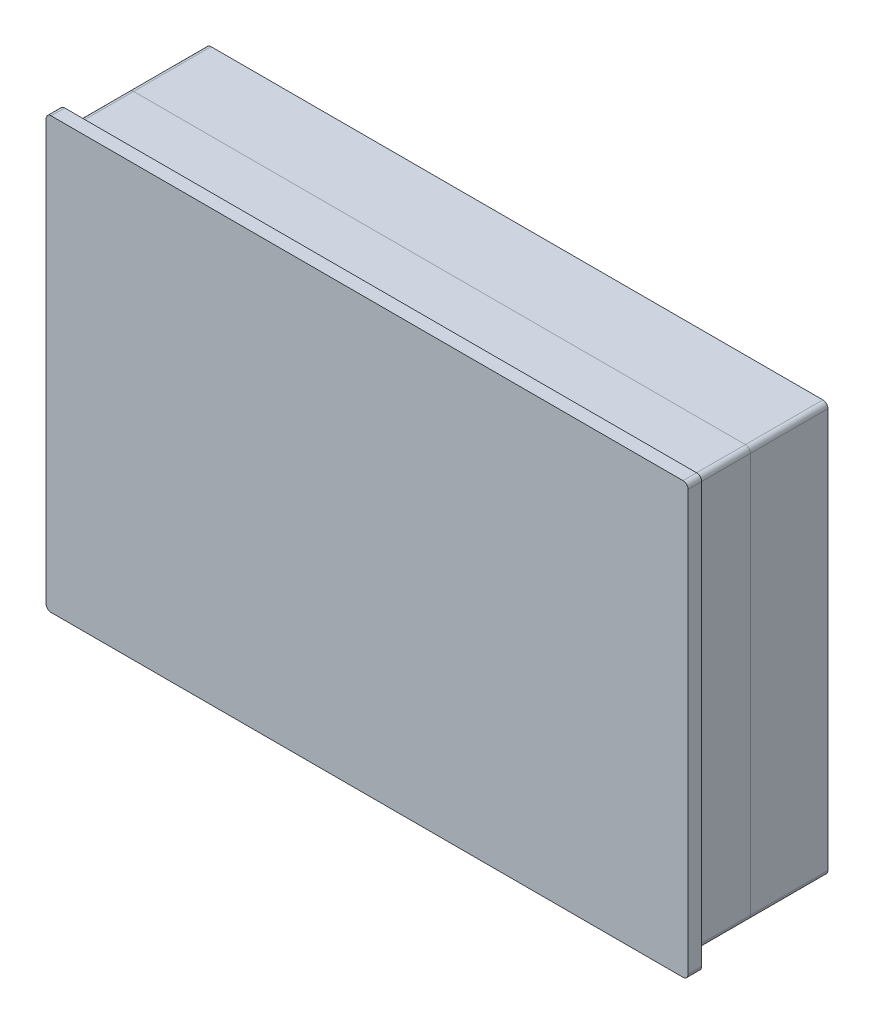
from build123d import *

# Parameters (mm, degrees)
SKETCH1_W           = 127.6
SKETCH1_H           = 85.5
BOSS_EXTRUDE1_DEPTH = 14.4
SKETCH2_W           = 127.6
SKETCH2_H           = 85.5
SKETCH2_W_2         = 123.6
SKETCH2_H_2         = 81.5
CUT_EXTRUDE1_DEPTH  = 11.7
SKETCH3_W           = 123.6
SKETCH3_H           = 81.5
BOSS_EXTRUDE2_DEPTH = 15.4
FILLET1_R           = 1
FILLET2_R           = 1


with BuildPart() as part:
    # Sketch1 → Boss-Extrude1 (new body)
    with BuildSketch(Plane.XY):
        with Locations((-77.146382855, -123.07484112)):
            Rectangle(SKETCH1_W, SKETCH1_H)
    extrude(amount=BOSS_EXTRUDE1_DEPTH)

    # Sketch2 → Cut-Extrude1 (cut)
    with BuildSketch(Plane(origin=(0, 0, 0), x_dir=(-1, 0, 0), z_dir=(0, 0, -1))):
        with Locations((77.146382855, -123.07484112)):
            Rectangle(SKETCH2_W, SKETCH2_H)
        with Locations((77.146382855, -123.07484112)):
            Rectangle(SKETCH2_W_2, SKETCH2_H_2, mode=Mode.SUBTRACT)
    extrude(amount=-CUT_EXTRUDE1_DEPTH, mode=Mode.SUBTRACT)

    # Fillet1
    fillet1_edges = [part.edges().sort_by_distance(p)[0] for p in [
        (-138.946382855, -82.32484112, 5.85),
        (-138.946382855, -163.82484112, 5.85),
        (-15.346382855, -163.82484112, 5.85),
        (-15.346382855, -82.32484112, 5.85),
        (-13.346382855, -165.82484112, 13.05),
        (-140.946382855, -165.82484112, 13.05),
        (-140.946382855, -80.32484112, 13.05),
        (-13.346382855, -80.32484112, 13.05),
    ]]
    fillet(fillet1_edges, radius=FILLET1_R)


with BuildPart() as body_2:
    # Sketch3 → Boss-Extrude2 (new body)
    with BuildSketch(Plane(origin=(0, 0, 0), x_dir=(-1, 0, 0), z_dir=(0, 0, -1))):
        with Locations((77.146382855, -123.07484112)):
            Rectangle(SKETCH3_W, SKETCH3_H)
    extrude(amount=BOSS_EXTRUDE2_DEPTH)

    # Fillet2
    fillet2_edges = [body_2.edges().sort_by_distance(p)[0] for p in [
        (-138.946382855, -163.82484112, -7.7),
        (-15.346382855, -163.82484112, -7.7),
        (-15.346382855, -82.32484112, -7.7),
        (-138.946382855, -82.32484112, -7.7),
    ]]
    fillet(fillet2_edges, radius=FILLET2_R)


solid = Compound([part.part, body_2.part])
